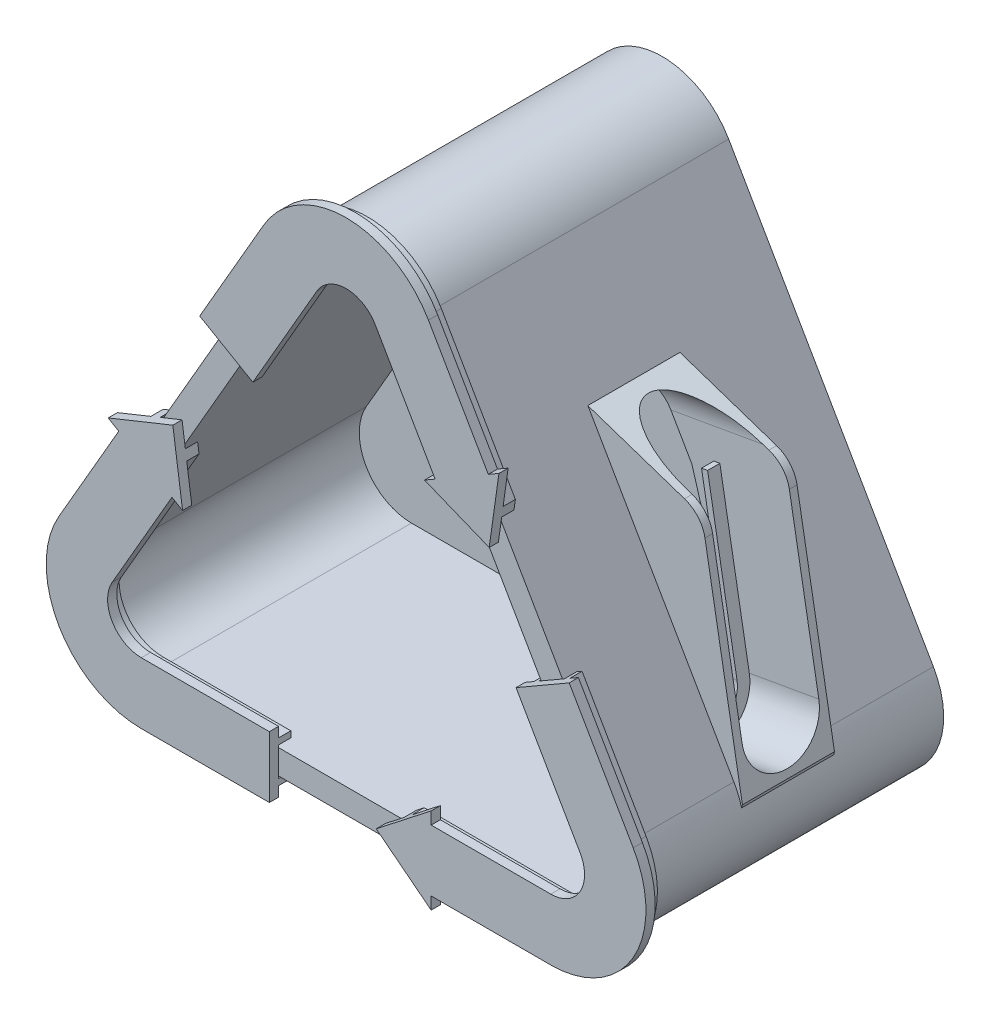
from build123d import *

# Parameters (mm, degrees)
BOSS_EXTRUDE1_DEPTH = 100
FILLET1_R           = 25
CUT_EXTRUDE1_DEPTH  = 85
BOSS_EXTRUDE3_DEPTH = 15
CUT_EXTRUDE3_REACH  = 260.16
CUT_EXTRUDE4_DEPTH  = 201.080927645
FILLET2_R           = 10
SKETCH7_R           = 7.5
CUT_EXTRUDE2_DEPTH  = 2
BOSS_EXTRUDE5_START = -23
BOSS_EXTRUDE5_DEPTH = 2
BOSS_EXTRUDE2_DEPTH = 3
BOSS_EXTRUDE6_DEPTH = 4
CIRPATTERN2_COUNT   = 3
CUT_EXTRUDE5_DEPTH  = 1.5


with BuildPart() as part:
    # Sketch2 → Boss-Extrude1 (new body)
    with BuildSketch(Plane.XY):
        Polygon((-110, 0), (110, 0), (0, 190.525588833), align=None)
    extrude(amount=BOSS_EXTRUDE1_DEPTH)

    # Fillet1
    fillet1_edges = [part.edges().sort_by_distance(p)[0] for p in [
        (110, 0, 50),
        (-110, 0, 50),
        (0, 190.525588833, 50),
    ]]
    fillet(fillet1_edges, radius=FILLET1_R)

    # Sketch3 → Cut-Extrude1 (cut)
    with BuildSketch(Plane.XY.offset(100)):
        with BuildLine():
            Line((-14.722431864, 149.025588833), (-81.421161675, 33.5))
            ThreePointArc((-81.421161675, 33.5), (-81.421161675, 16.5), (-66.698729811, 8))
            Line((-66.698729811, 8), (66.698729811, 8))
            ThreePointArc((66.698729811, 8), (81.421161675, 16.5), (81.421161675, 33.5))
            Line((81.421161675, 33.5), (14.722431864, 149.025588833))
            ThreePointArc((14.722431864, 149.025588833), (0, 157.525588833), (-14.722431864, 149.025588833))
        make_face()
    extrude(amount=-CUT_EXTRUDE1_DEPTH, mode=Mode.SUBTRACT)

    # Sketch10 → Boss-Extrude3 (add, symmetric)
    with BuildSketch(Plane.XY.offset(50)):
        Polygon((91.129492757, 32.415185314), (74.632915879, 125.97192185), (37.27007701, 125.97192185), (66.460058544, 28.065298463), (66.460058544, 8), (84.699438886, 8), align=None)
    extrude(amount=BOSS_EXTRUDE3_DEPTH, both=True)

    # Sketch12 → Cut-Extrude3 (cut, up to next)
    with BuildSketch(Plane(origin=(93.924925482, 16.561498524, 0), x_dir=(0, 0, -1), z_dir=(0.984807753012208, 0.17364817766693155, 0)), mode=Mode.PRIVATE) as cut_extrude3_sk1:
        with BuildLine():
            Line((-62.5, 31.098255463), (-62.5, 96.098255463))
            ThreePointArc((-62.5, 96.098255463), (-50, 108.598255463), (-37.5, 96.098255463))
            Line((-37.5, 96.098255463), (-37.5, 31.098255463))
            ThreePointArc((-37.5, 31.098255463), (-50, 18.598255463), (-62.5, 31.098255463))
        make_face()
    cut_extrude3_tool1 = extrude(cut_extrude3_sk1.sketch, amount=-CUT_EXTRUDE3_REACH, mode=Mode.PRIVATE) & part.part
    add(cut_extrude3_tool1.solids().sort_by_distance((82.881204, 79.193554, 50))[0], mode=Mode.SUBTRACT)

    # Sketch14 → Cut-Extrude4 (cut, through all)
    with BuildSketch(Plane.XY.offset(65)):
        Polygon((77.898996966, 107.449055557), (40.775087243, 119.901066044), (37.27007701, 125.97192185), (74.632915879, 125.97192185), align=None)
    extrude(amount=-CUT_EXTRUDE4_DEPTH, mode=Mode.SUBTRACT)

    # Fillet2
    fillet2_edges = [part.edges().sort_by_distance(p)[0] for p in [
        (77.898996966, 107.449055557, 36.25),
        (77.898996966, 107.449055557, 63.75),
    ]]
    fillet(fillet2_edges, radius=FILLET2_R)

    # Sketch7 → Cut-Extrude2 (cut)
    with BuildSketch(Plane.XZ):
        with Locations((-51.698729811, 85)):
            Circle(SKETCH7_R)
        with Locations(Location((51.698729811, 85, 0), (0, 0, 180))):
            Circle(SKETCH7_R)
        with Locations((51.698729811, 15)):
            Circle(SKETCH7_R)
        with Locations(Location((-51.698729811, 15, 0), (0, 0, 180))):
            Circle(SKETCH7_R)
    extrude(amount=-CUT_EXTRUDE2_DEPTH, mode=Mode.SUBTRACT)

    # Sketch16 → Boss-Extrude5 (add)
    with BuildSketch(Plane(origin=(93.924925482, 16.561498524, 0), x_dir=(0, 0, -1), z_dir=(0.984807753012208, 0.17364817766693155, 0)).offset(BOSS_EXTRUDE5_START)):
        with BuildLine():
            ThreePointArc((-41.5, 31.098255463), (-50, 22.598255463), (-58.5, 31.098255463))
            Line((-58.5, 31.098255463), (-58.5, 86.345272758))
            Line((-58.5, 86.345272758), (-62.5, 86.345272758))
            Line((-62.5, 86.345272758), (-62.5, 31.098255463))
            ThreePointArc((-62.5, 31.098255463), (-50, 18.598255463), (-37.5, 31.098255463))
            Line((-37.5, 31.098255463), (-37.5, 86.345272758))
            Line((-37.5, 86.345272758), (-41.5, 86.345272758))
            Line((-41.5, 86.345272758), (-41.5, 31.098255463))
        make_face()
    extrude(amount=-BOSS_EXTRUDE5_DEPTH)

    # Sketch18 → Cut-Extrude5 (cut)
    with BuildSketch(Plane(origin=(0, 0, 0), x_dir=(-1, 0, 0), z_dir=(0, 0, -1))):
        Polygon((-37.919556607, 65.125848478), (-31.75819654, 53.463274067), (-32.968463696, 47.081865426), (-26.917127916, 44.881379688), (-21.670626899, 51.550114307), (-21.670626899, 48.952278304), (-15.707481706, 37.664896332), (-10.155437558, 33.296930452), (-4.852685714, 33.929880742), (0, 33.009543797), (3.674613695, 34.950849145), (9.317840885, 33.209112358), (13.613951468, 37.020390594), (20.63173876, 49.677471246), (20.63173876, 51.550114307), (25.017855817, 45.416671819), (27.273573161, 45.416671819), (31.659690219, 47.081865426), (30.89798864, 53.463274067), (37.364366532, 65.125848478), (23.646346617, 82.733598753), (14.271715742, 84.511545988), (10.141009459, 87.761301145), (-0.471836706, 86.857944003), (-10.901483393, 87.309622574), (-15.707481706, 84.770604597), (-24.764816463, 82.733598753), align=None)
    extrude(amount=-CUT_EXTRUDE5_DEPTH, mode=Mode.SUBTRACT)


with BuildPart() as body_2:
    # Sketch6 → Boss-Extrude2 (new body)
    with BuildSketch(Plane.XY.offset(100)):
        with BuildLine():
            Line((46.337748112, 122.266254794), (26.846787517, 156.025588833))
            ThreePointArc((26.846787517, 156.025588833), (0, 171.525588833), (-26.846787517, 156.025588833))
            Line((-26.846787517, 156.025588833), (-47.696152423, 119.913429511))
            Line((-47.696152423, 119.913429511), (-30.375644347, 109.913429511))
            Line((-30.375644347, 109.913429511), (-9.526279442, 146.025588833))
            ThreePointArc((-9.526279442, 146.025588833), (0, 151.525588833), (9.526279442, 146.025588833))
            Line((9.526279442, 146.025588833), (29.017240037, 112.266254794))
            Line((29.017240037, 112.266254794), (25.553138421, 110.266254794))
            Line((25.553138421, 110.266254794), (46.625524096, 101.767812169))
            Line((46.625524096, 101.767812169), (49.801849727, 124.266254794))
            Line((49.801849727, 124.266254794), (46.337748112, 122.266254794))
        make_face()
    extrude(amount=BOSS_EXTRUDE2_DEPTH)

    # Sketch19 → Boss-Extrude6 (add)
    with BuildSketch(Plane(origin=(0, 0, 100), x_dir=(-1, 0, 0), z_dir=(0, 0, -1))):
        with BuildLine():
            Line((22.300154147, 153.400588833), (43.149519053, 117.288429511))
            Line((43.149519053, 117.288429511), (44.88156986, 118.288429511))
            Line((44.88156986, 118.288429511), (24.032204955, 154.400588833))
            ThreePointArc((24.032204955, 154.400588833), (0, 168.275588833), (-24.032204955, 154.400588833))
            Line((-24.032204955, 154.400588833), (-48.156966811, 112.615275577))
            Line((-48.156966811, 112.615275577), (-47.703206007, 109.401212345))
            Line((-47.703206007, 109.401212345), (-22.300154147, 153.400588833))
            ThreePointArc((-22.300154147, 153.400588833), (0, 166.275588833), (22.300154147, 153.400588833))
        make_face()
        with BuildLine():
            Line((33.190226909, 111.538429511), (34.922277717, 112.538429511))
            Line((34.922277717, 112.538429511), (14.072912811, 148.650588833))
            ThreePointArc((14.072912811, 148.650588833), (0, 156.775588833), (-14.072912811, 148.650588833))
            Line((-14.072912811, 148.650588833), (-39.475964671, 104.651212345))
            Line((-39.475964671, 104.651212345), (-36.46562386, 105.865275577))
            Line((-36.46562386, 105.865275577), (-12.340862004, 147.650588833))
            ThreePointArc((-12.340862004, 147.650588833), (0, 154.775588833), (12.340862004, 147.650588833))
            Line((12.340862004, 147.650588833), (33.190226909, 111.538429511))
        make_face()
    extrude(amount=BOSS_EXTRUDE6_DEPTH)


with BuildPart() as cirpattern2_1:
    # CirPattern2: pattern copy
    add(body_2.part.rotate(Axis((0, 63.508529611, 0), (0, 0, 1)), 1 * 360 / CIRPATTERN2_COUNT))


with BuildPart() as cirpattern2_2:
    # CirPattern2: pattern copy
    add(body_2.part.rotate(Axis((0, 63.508529611, 0), (0, 0, 1)), 2 * 360 / CIRPATTERN2_COUNT))


solid = Compound([part.part, body_2.part, cirpattern2_1.part, cirpattern2_2.part])
